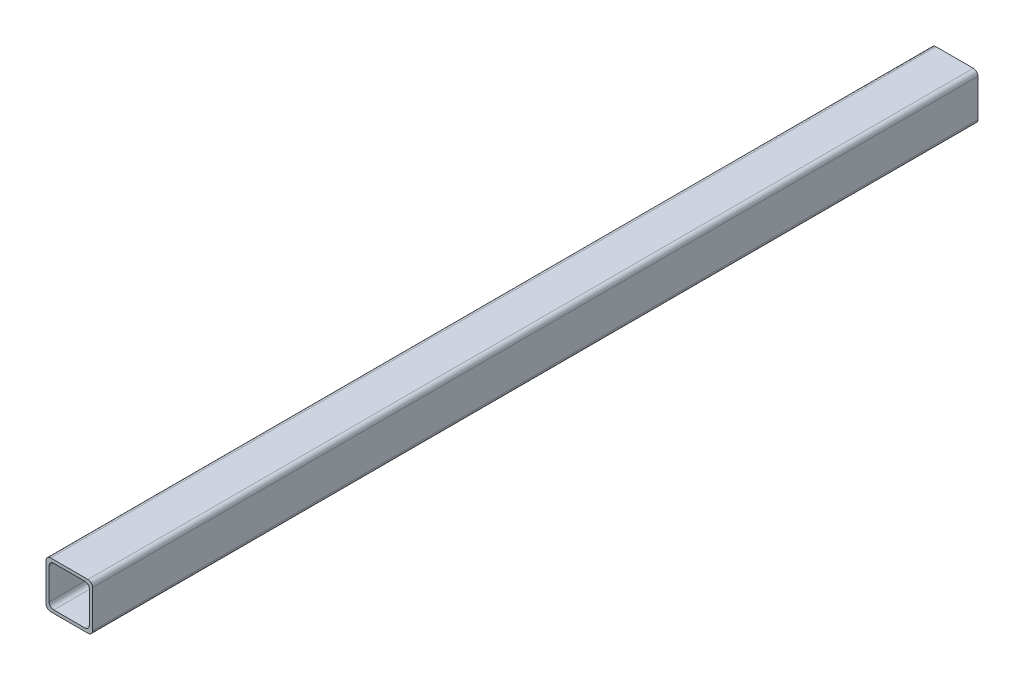
from build123d import *

# Parameters (mm, degrees)
BOSS_EXTRU_1_DEPTH = 570


with BuildPart() as part:
    # Esquisse1 → Boss.-Extru.1 (new body)
    with BuildSketch(Plane.XY):
        with BuildLine():
            Line((-12, -15), (12, -15))
            ThreePointArc((12, -15), (14.121320344, -14.121320344), (15, -12))
            Line((15, -12), (15, 12))
            ThreePointArc((15, 12), (14.121320344, 14.121320344), (12, 15))
            Line((12, 15), (-12, 15))
            ThreePointArc((-12, 15), (-14.121320344, 14.121320344), (-15, 12))
            Line((-15, 12), (-15, -12))
            ThreePointArc((-15, -12), (-14.121320344, -14.121320344), (-12, -15))
        make_face()
        with BuildLine():
            Line((-10, -13), (10, -13))
            ThreePointArc((10, -13), (12.121320344, -12.121320344), (13, -10))
            Line((13, -10), (13, 10))
            ThreePointArc((13, 10), (12.121320344, 12.121320344), (10, 13))
            Line((10, 13), (-10, 13))
            ThreePointArc((-10, 13), (-12.121320344, 12.121320344), (-13, 10))
            Line((-13, 10), (-13, -10))
            ThreePointArc((-13, -10), (-12.121320344, -12.121320344), (-10, -13))
        make_face(mode=Mode.SUBTRACT)
    extrude(amount=-BOSS_EXTRU_1_DEPTH)


solid = part.part
